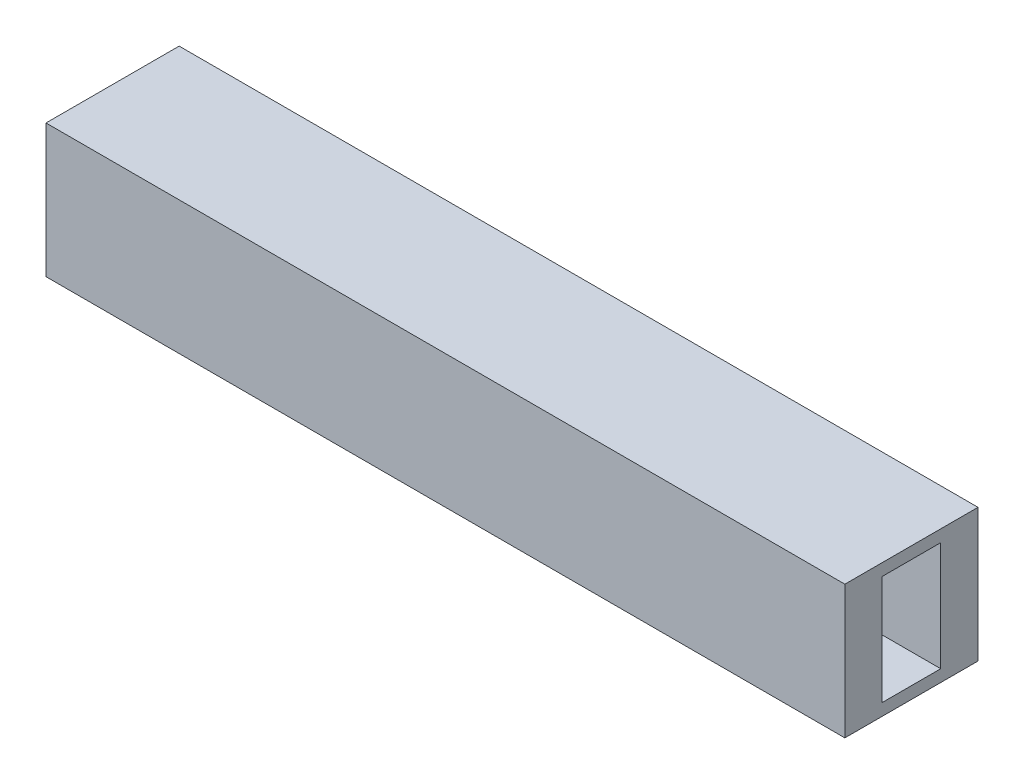
from build123d import *

# Parameters (mm, degrees)
SKETCH1_W           = 50
SKETCH1_H           = 50
BOSS_EXTRUDE1_DEPTH = 300
CUT_EXTRUDE2_REACH  = 304.076
SKETCH3_W           = 22
SKETCH3_H           = 41


with BuildPart() as part:
    # Sketch1 → Boss-Extrude1 (new body)
    with BuildSketch(Plane(origin=(0, 0, 0), x_dir=(0, 0, -1), z_dir=(1, 0, 0))):
        Rectangle(SKETCH1_W, SKETCH1_H)
    extrude(amount=BOSS_EXTRUDE1_DEPTH)

    # Sketch3 → Cut-Extrude2 (cut, up to next)
    with BuildSketch(Plane.ZY, mode=Mode.PRIVATE) as cut_extrude2_sk1:
        Rectangle(SKETCH3_W, SKETCH3_H)
    cut_extrude2_tool1 = extrude(cut_extrude2_sk1.sketch, amount=-CUT_EXTRUDE2_REACH, mode=Mode.PRIVATE) & part.part
    add(cut_extrude2_tool1.solids().sort_by_distance((0, 0, 0))[0], mode=Mode.SUBTRACT)


solid = part.part
